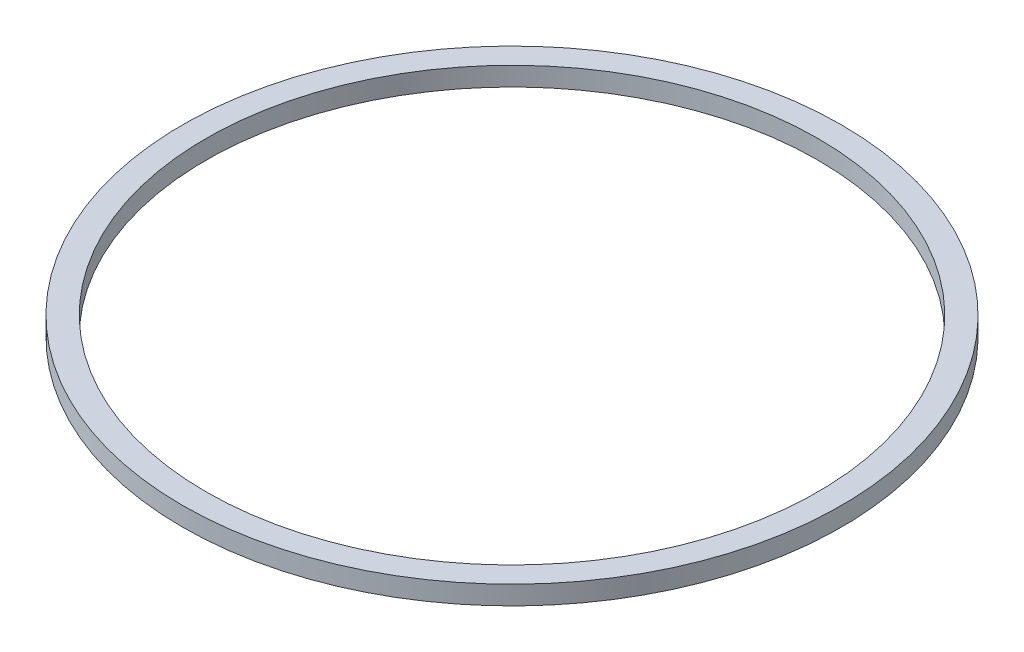
from build123d import *

# Parameters (mm, degrees)
SKETCH1_R           = 350
SKETCH1_R_2         = 325
BOSS_EXTRUDE1_DEPTH = 10


with BuildPart() as part:
    # Sketch1 → Boss-Extrude1 (new, symmetric)
    with BuildSketch(Plane(origin=(0, 0, 0), x_dir=(1, 0, 0), z_dir=(0, 1, 0))):
        with Locations(Location((0, 0, 0), (0, 0, 270))):
            Circle(SKETCH1_R)
        with Locations(Location((0, 0, 0), (0, 0, 270))):
            Circle(SKETCH1_R_2, mode=Mode.SUBTRACT)
    extrude(amount=BOSS_EXTRUDE1_DEPTH, both=True)


solid = part.part
